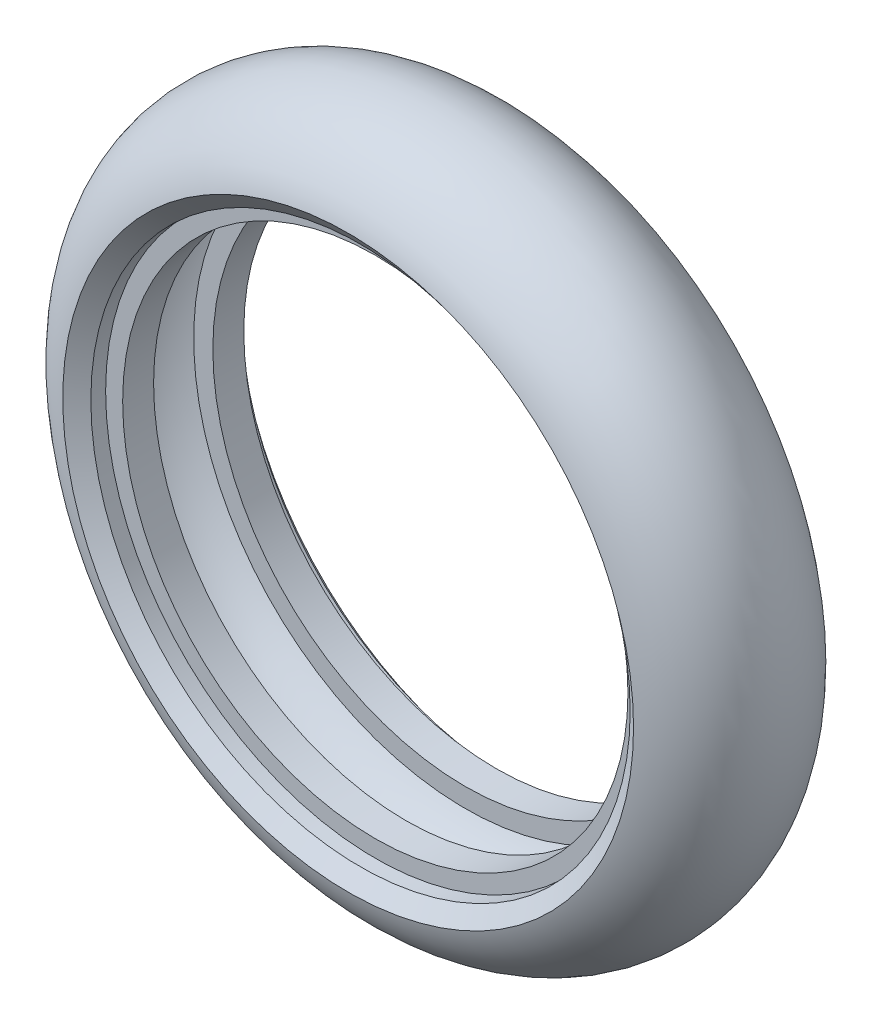
from build123d import *


with BuildPart() as part:
    # Schizzo1 → Rivoluzione1 (revolve)
    with BuildSketch(Plane(origin=(0, 0, 0), x_dir=(0, 0, -1), z_dir=(1, 0, 0)), mode=Mode.PRIVATE) as rivoluzione1_sk:
        with BuildLine():
            Line((-13.75, -3.75297619), (-11.815, -1.28797619))
            Line((-11.815, -1.28797619), (-9.495, -1.28797619))
            Line((-9.495, -1.28797619), (-9.495, 1.38202381))
            Line((-9.495, 1.38202381), (-4.645, 1.38202381))
            Line((-4.645, 1.38202381), (-4.645, -1.61797619))
            Line((-4.645, -1.61797619), (-10.241809827, -2.522914521))
            Line((-10.241809827, -2.522914521), (-11.525724899, -4.158496253))
            ThreePointArc((-11.525724899, -4.158496253), (-7.042068941, -10.027197542), (0, -12.25297619))
            ThreePointArc((0, -12.25297619), (7.042068941, -10.027197542), (11.525724899, -4.158496253))
            Line((11.525724899, -4.158496253), (10.241809827, -2.522914521))
            Line((10.241809827, -2.522914521), (4.645, -1.61797619))
            Line((4.645, -1.61797619), (4.645, 1.38202381))
            Line((4.645, 1.38202381), (9.495, 1.38202381))
            Line((9.495, 1.38202381), (9.495, -1.28797619))
            Line((9.495, -1.28797619), (11.815, -1.28797619))
            Line((11.815, -1.28797619), (13.75, -3.75297619))
            ThreePointArc((13.75, -3.75297619), (8.650325138, -11.327806729), (0, -14.25297619))
            ThreePointArc((0, -14.25297619), (-8.650325138, -11.327806729), (-13.75, -3.75297619))
        make_face()
    revolve(rivoluzione1_sk.sketch.rotate(Axis((0, 40.99702381, 83.136994768), (0, 0, -1)), 270), axis=Axis((0, 40.99702381, 83.136994768), (0, 0, -1)))


solid = part.part
